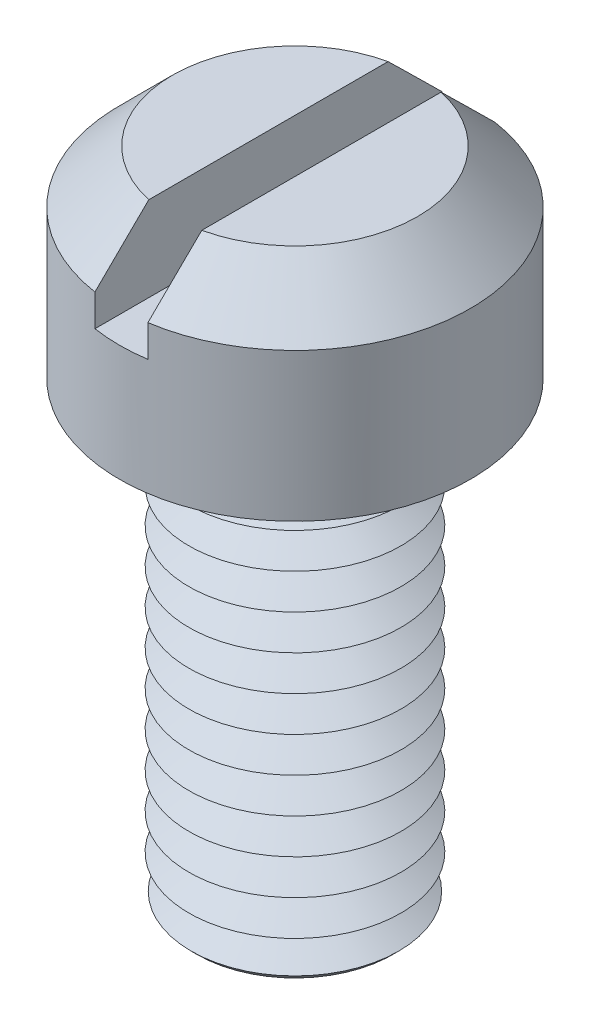
from build123d import *

# Parameters (mm, degrees)
SKETCH2_W            = 0.5461
SKETCH2_H            = 32.152963302
HEX_CUT_DRIVEN_DEPTH = 0.87376


with BuildPart() as part:
    # Sketch3 → Shank Revolve ( driven ) (revolve)
    with BuildSketch(Plane.XY, mode=Mode.PRIVATE) as shank_revolve_driven_sk:
        Polygon((0, 1.1970512), (0, -4.7752), (0.87376, -4.7752), (1.0922, -4.55676), (1.0922, 1.1970512), align=None)
    revolve(shank_revolve_driven_sk.sketch.rotate(Axis((0, -50, 0), (0, 1, 0)), 90), axis=Axis((0, -50, 0), (0, 1, 0)))

    # Sketch4 → Thread Revolve Cut ( driven ) (revolve, cut)
    with BuildSketch(Plane.XY, mode=Mode.PRIVATE) as thread_revolve_cut_driven_sk:
        Polygon((0.776909018, 0.6858), (1.0922, 0.867833333), (1.6002, 0.867833333), (1.6002, -5.685366667), (1.0922, -5.685366667), (0.776909018, -5.503333333), (1.0922, -5.3213), (0.776909018, -5.139266667), (1.0922, -4.957233333), (0.776909018, -4.7752), (1.0922, -4.593166667), (0.776909018, -4.411133333), (1.0922, -4.2291), (0.776909018, -4.047066667), (1.0922, -3.865033333), (0.776909018, -3.683), (1.0922, -3.500966667), (0.776909018, -3.318933333), (1.0922, -3.1369), (0.776909018, -2.954866667), (1.0922, -2.772833333), (0.776909018, -2.5908), (1.0922, -2.408766667), (0.776909018, -2.226733333), (1.0922, -2.0447), (0.776909018, -1.862666667), (1.0922, -1.680633333), (0.776909018, -1.4986), (1.0922, -1.316566667), (0.776909018, -1.134533333), (1.0922, -0.9525), (0.776909018, -0.770466667), (1.0922, -0.588433333), (0.776909018, -0.4064), (1.0922, -0.224366667), (0.776909018, -0.042333333), (1.0922, 0.1397), (0.776909018, 0.321733333), (1.0922, 0.503766667), align=None)
    revolve(thread_revolve_cut_driven_sk.sketch.rotate(Axis((0, -50, 0), (0, 1, 0)), 90), axis=Axis((0, -50, 0), (0, 1, 0)), mode=Mode.SUBTRACT)

    # Sketch5 → Head Revolve ( driven ) (revolve)
    with BuildSketch(Plane.XY, mode=Mode.PRIVATE) as head_revolve_driven_sk:
        Polygon((0, 2.0708112), (0, 0), (1.8086832, 0), (1.8086832, 1.5247112), (1.2625832, 2.0708112), align=None)
    revolve(head_revolve_driven_sk.sketch.rotate(Axis((0, -50, 0), (0, 1, 0)), 90), axis=Axis((0, -50, 0), (0, 1, 0)))

    # Sketch2 → Hex Cut ( driven ) (cut)
    with BuildSketch(Plane(origin=(0, 2.0708112, 0), x_dir=(-1, 0, 0), z_dir=(0, 1, 0))):
        Rectangle(SKETCH2_W, SKETCH2_H)
    extrude(amount=-HEX_CUT_DRIVEN_DEPTH, mode=Mode.SUBTRACT)


solid = part.part
